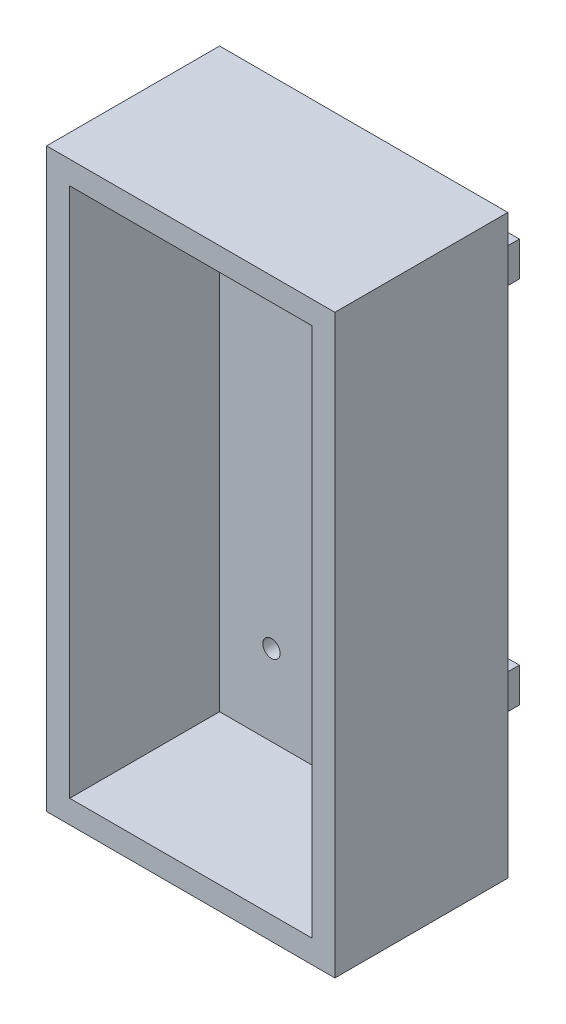
from build123d import *

# Parameters (mm, degrees)
SKETCH1_W               = 50
SKETCH1_H               = 100
BOSS_EXTRUDE1_DEPTH     = 30
SKETCH2_W               = 42
SKETCH2_H               = 92
CUT_EXTRUDE1_DEPTH      = 26
SKETCH3_W               = 30
SKETCH3_H               = 6
BOSS_EXTRUDE2_DEPTH     = 24
CUT_EXTRUDE2_DEPTH      = 104.07764064
CUT_EXTRUDE2_DEPTH_BACK = 104.07764064
SKETCH4_R               = 9
CUT_EXTRUDE3_DEPTH      = 125.161185561
CUT_EXTRUDE3_DEPTH_BACK = 125.161185561
SKETCH5_R               = 1.5
CUT_EXTRUDE4_DEPTH      = 104.07764064
CUT_EXTRUDE4_DEPTH_BACK = 104.07764064
SKETCH6_W               = 30
SKETCH6_H               = 12


with BuildPart() as part:
    # Sketch1 → Boss-Extrude1 (new body)
    with BuildSketch(Plane.XY):
        with Locations((25, 50)):
            Rectangle(SKETCH1_W, SKETCH1_H)
    extrude(amount=BOSS_EXTRUDE1_DEPTH)

    # Sketch2 → Cut-Extrude1 (cut)
    with BuildSketch(Plane.XY.offset(30)):
        with Locations((25, 50)):
            Rectangle(SKETCH2_W, SKETCH2_H)
    extrude(amount=-CUT_EXTRUDE1_DEPTH, mode=Mode.SUBTRACT)

    # Sketch3 → Boss-Extrude2 (add)
    with BuildSketch(Plane(origin=(0, 0, 0), x_dir=(-1, 0, 0), z_dir=(0, 0, -1))):
        with Locations((-25, 18)):
            Rectangle(SKETCH3_W, SKETCH3_H)
        with Locations((-25, 82)):
            Rectangle(SKETCH3_W, SKETCH3_H)
    extrude(amount=BOSS_EXTRUDE2_DEPTH)

    # Sketch4 → Cut-Extrude2 (cut, two sides: drawn at the far end of the back side and taken through both)
    with BuildSketch(Plane.XZ.offset(-15).offset(-CUT_EXTRUDE2_DEPTH_BACK)):
        with Locations((25, -12)):
            Circle(SKETCH4_R)
    extrude(amount=CUT_EXTRUDE2_DEPTH + CUT_EXTRUDE2_DEPTH_BACK, mode=Mode.SUBTRACT)

    # Sketch5 → Cut-Extrude3 (cut, two sides: drawn at the far end of the back side and taken through both)
    with BuildSketch(Plane(origin=(0, 0, -24), x_dir=(-1, 0, 0), z_dir=(0, 0, -1)).offset(-CUT_EXTRUDE3_DEPTH_BACK)):
        with Locations((-13, 18)):
            Circle(SKETCH5_R)
        with Locations((-37, 18)):
            Circle(SKETCH5_R)
        with Locations((-13, 82)):
            Circle(SKETCH5_R)
        with Locations((-37, 82)):
            Circle(SKETCH5_R)
    extrude(amount=CUT_EXTRUDE3_DEPTH + CUT_EXTRUDE3_DEPTH_BACK, mode=Mode.SUBTRACT)

    # Sketch6 → Cut-Extrude4 (cut, two sides: drawn at the far end of the back side and taken through both)
    with BuildSketch(Plane.XZ.offset(-15).offset(-CUT_EXTRUDE4_DEPTH_BACK)):
        with Locations((25, -18)):
            Rectangle(SKETCH6_W, SKETCH6_H)
    extrude(amount=CUT_EXTRUDE4_DEPTH + CUT_EXTRUDE4_DEPTH_BACK, mode=Mode.SUBTRACT)


solid = part.part
